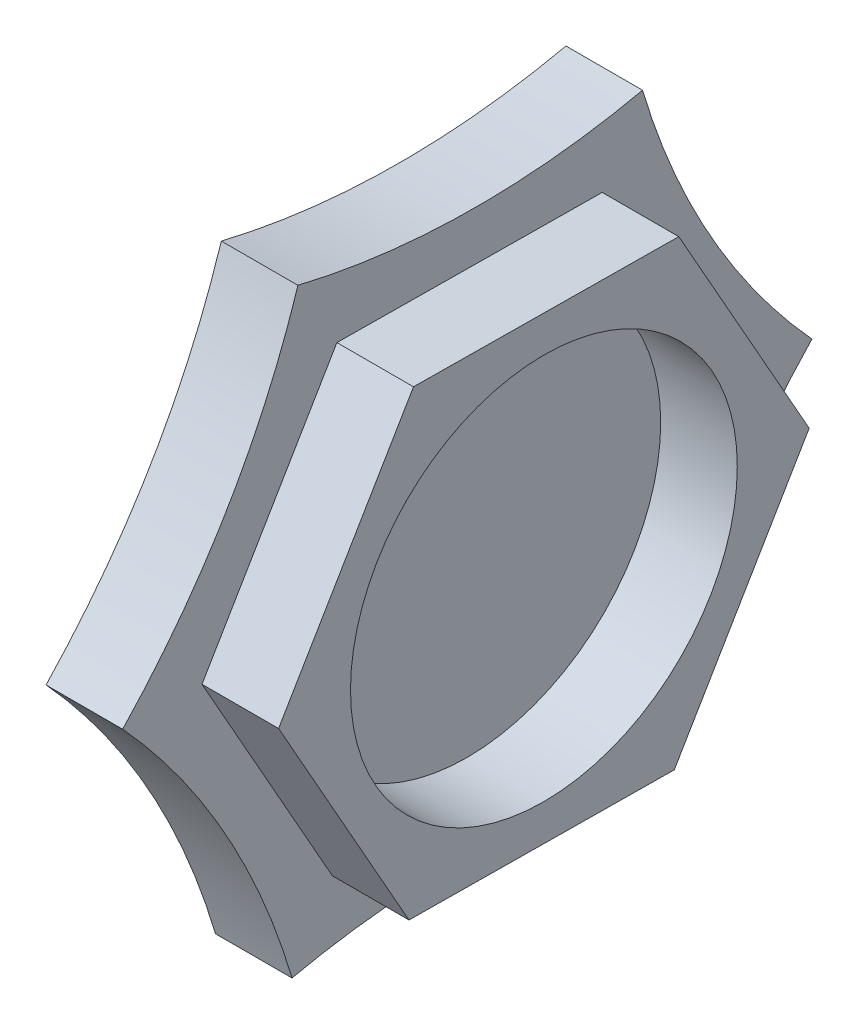
from build123d import *

# Parameters (mm, degrees)
BOSS_EXTRUDE1_DEPTH = 5.08
BOSS_EXTRUDE2_DEPTH = 5.08
SKETCH3_R           = 12.827
CUT_EXTRUDE1_DEPTH  = 5.08
CUT_EXTRUDE2_DEPTH  = 0.254


with BuildPart() as part:
    # Sketch1 → Boss-Extrude1 (new body)
    with BuildSketch(Plane(origin=(0, 0, 0), x_dir=(0, 0, -1), z_dir=(1, 0, 0))):
        with BuildLine():
            ThreePointArc((-11.624458926, -19.685069817), (-0.181663781, -18.494701427), (11.235541074, -19.909611644))
            ThreePointArc((11.235541074, -19.909611644), (15.92604938, -9.404676163), (22.86, -0.224541827))
            ThreePointArc((22.86, -0.224541827), (16.107713162, 9.090025264), (11.624458926, 19.685069817))
            ThreePointArc((11.624458926, 19.685069817), (0.181663781, 18.494701427), (-11.235541074, 19.909611644))
            ThreePointArc((-11.235541074, 19.909611644), (-15.92604938, 9.404676163), (-22.86, 0.224541827))
            ThreePointArc((-22.86, 0.224541827), (-16.107713162, -9.090025264), (-11.624458926, -19.685069817))
        make_face()
    extrude(amount=BOSS_EXTRUDE1_DEPTH)

    # Sketch2 → Boss-Extrude2 (add)
    with BuildSketch(Plane(origin=(5.08, 0, 0), x_dir=(0, 0, -1), z_dir=(1, 0, 0))):
        Polygon((8.648706343, -15.325686888), (17.596787347, -0.172844041), (8.948081004, 15.152842847), (-8.648706343, 15.325686888), (-17.596787347, 0.172844041), (-8.948081004, -15.152842847), align=None)
    extrude(amount=BOSS_EXTRUDE2_DEPTH)

    # Sketch3 → Cut-Extrude1 (cut)
    with BuildSketch(Plane(origin=(10.16, 0, 0), x_dir=(0, 0, -1), z_dir=(1, 0, 0))):
        Circle(SKETCH3_R)
    extrude(amount=-CUT_EXTRUDE1_DEPTH, mode=Mode.SUBTRACT)

    # Sketch4 → Cut-Extrude2 (cut)
    # profile 1 of 12: a face of its own
    with BuildSketch(Plane.ZY):
        with BuildLine():
            Line((-6.151828843, 2.577396125), (-6.583048795, 2.164620684))
            add(Edge.make_bspline(
                [(-6.583048795, 2.164620684), (-6.617189231, 2.198802026), (-6.684178403, 2.265871463), (-6.793730813, 2.353166944), (-6.907193862, 2.427385361), (-7.024941003, 2.488412934), (-7.147136256, 2.535751226), (-7.27353848, 2.569613821), (-7.404353314, 2.5896983), (-7.492909117, 2.592510059), (-7.537711255, 2.593932583)],
                knots=[0, 0, 0, 0, 1.075575784, 2.110457258, 3.113929901, 4.09197124, 5.059417775, 6.02750972, 7.002078037, 8, 8, 8, 8], degree=3))
            add(Edge.make_bspline(
                [(-7.537711255, 2.593932583), (-7.576553338, 2.592935827), (-7.652823174, 2.590978608), (-7.764894352, 2.576115623), (-7.871985228, 2.551287676), (-7.974601743, 2.5168927), (-8.072117388, 2.472133965), (-8.165097186, 2.417702271), (-8.252968939, 2.35318121), (-8.335040721, 2.279793877), (-8.409767342, 2.199669726), (-8.475007628, 2.113908552), (-8.530578336, 2.024108871), (-8.576324362, 1.929811254), (-8.611132113, 1.831160429), (-8.635980293, 1.728228012), (-8.651752708, 1.621313139), (-8.653614959, 1.548374705), (-8.65455821, 1.51143058)],
                knots=[0, 0, 0, 0, 1.075001177, 2.110859044, 3.123021556, 4.114053297, 5.101481495, 6.087880186, 7.091499647, 8.114004866, 9.131394192, 10.11971144, 11.092043119, 12.050101265, 13.015322563, 13.981809771, 14.977764287, 16, 16, 16, 16], degree=3))
            add(Edge.make_bspline(
                [(-8.65455821, 1.51143058), (-8.65367839, 1.473207769), (-8.651945026, 1.3979036), (-8.635294102, 1.287391493), (-8.609640488, 1.181070884), (-8.572090436, 1.079730645), (-8.525877694, 0.981982557), (-8.467272323, 0.889720094), (-8.398932596, 0.801534306), (-8.320980626, 0.718960559), (-8.236189014, 0.642847437), (-8.144356939, 0.577190298), (-8.048278496, 0.52054236), (-7.946402975, 0.475679024), (-7.840498633, 0.439658681), (-7.729491296, 0.414261247), (-7.613630925, 0.39868001), (-7.534580439, 0.396806482), (-7.494462056, 0.39585566)],
                knots=[0, 0, 0, 0, 1.022067601, 2.013613092, 2.983553406, 3.943623673, 4.90013463, 5.87121881, 6.861774014, 7.881098904, 8.905697761, 9.905387765, 10.89678721, 11.884561068, 12.87834324, 13.885584958, 14.926927371, 16, 16, 16, 16], degree=3))
            add(Edge.make_bspline(
                [(-7.494462056, 0.39585566), (-7.468366533, 0.396091115), (-7.417135216, 0.396553367), (-7.341987604, 0.404057005), (-7.270014241, 0.414784329), (-7.200936395, 0.428986033), (-7.135451566, 0.449083991), (-7.072653072, 0.472586078), (-7.012908857, 0.500323227), (-6.956542848, 0.533252422), (-6.902716155, 0.570162023), (-6.851932606, 0.612394457), (-6.803301399, 0.658997535), (-6.757390782, 0.710540582), (-6.714977806, 0.767484453), (-6.674703667, 0.828782728), (-6.637029498, 0.895043756), (-6.614768825, 0.941833937), (-6.603401359, 0.965727455)],
                knots=[0, 0, 0, 0, 1.109579412, 2.178351274, 3.208885622, 4.204702371, 5.174744997, 6.119429583, 7.05542196, 7.97267548, 8.893247984, 9.828544973, 10.778894627, 11.756245826, 12.760884819, 13.796418446, 14.874735809, 16, 16, 16, 16], degree=3))
            Line((-6.603401359, 0.965727455), (-7.51481462, 0.965727455))
            Line((-7.51481462, 0.965727455), (-7.51481462, 1.53559925))
            Line((-7.51481462, 1.53559925), (-5.931766743, 1.53559925))
            Line((-5.931766743, 1.53559925), (-5.92731462, 1.400127495))
            add(Edge.make_bspline(
                [(-5.92731462, 1.400127495), (-5.927886685, 1.365334911), (-5.929029793, 1.295811833), (-5.939476606, 1.192303815), (-5.956781593, 1.090168615), (-5.980439167, 0.989508817), (-6.010088091, 0.889830648), (-6.047899751, 0.792088609), (-6.092176973, 0.695619846), (-6.14178646, 0.600834277), (-6.197533249, 0.509884947), (-6.257552852, 0.423767937), (-6.320989651, 0.342632298), (-6.389223367, 0.267608452), (-6.461191492, 0.198066165), (-6.537035693, 0.134272976), (-6.617024229, 0.076174908), (-6.700733369, 0.023281163), (-6.788639916, -0.023077083), (-6.88026056, -0.063402607), (-6.975456967, -0.097650223), (-7.074474912, -0.125725818), (-7.177119552, -0.147388373), (-7.283393085, -0.162242415), (-7.393353879, -0.172335904), (-7.46793796, -0.173449287), (-7.505910373, -0.174016135)],
                knots=[0, 0, 0, 0, 1.006889344, 2.011981806, 3.007738725, 4.003571281, 5.003404394, 6.015442001, 7.03424805, 8.074616296, 9.110249922, 10.119753985, 11.111721717, 12.089233633, 13.052717867, 14.006597561, 14.955430184, 15.912305663, 16.870361111, 17.829300583, 18.807640451, 19.796414044, 20.806216501, 21.841577364, 22.90109906, 24, 24, 24, 24], degree=3))
            add(Edge.make_bspline(
                [(-7.505910373, -0.174016135), (-7.546424364, -0.173456362), (-7.626735176, -0.172346725), (-7.745485477, -0.161954221), (-7.860790757, -0.144802064), (-7.972679777, -0.121064064), (-8.081412321, -0.091520228), (-8.186801568, -0.054435724), (-8.288631971, -0.010322534), (-8.387208462, 0.039651207), (-8.481271128, 0.096325783), (-8.570609158, 0.158707398), (-8.654734928, 0.227197325), (-8.734510148, 0.300649026), (-8.80807096, 0.380867953), (-8.878158687, 0.46525382), (-8.94137782, 0.556901565), (-9.000446593, 0.65283994), (-9.052923763, 0.753028743), (-9.098815803, 0.855614929), (-9.137952508, 0.960004525), (-9.168812746, 1.066683603), (-9.19386837, 1.174908308), (-9.211796138, 1.285149283), (-9.221920787, 1.397392729), (-9.223589885, 1.472826139), (-9.224430005, 1.510794562)],
                knots=[0, 0, 0, 0, 1.084149091, 2.14910686, 3.187506334, 4.202448172, 5.208724393, 6.201130722, 7.189831603, 8.176984443, 9.156919086, 10.126598231, 11.090766514, 12.05840148, 13.026036446, 14.001772938, 14.991905635, 16.003017641, 17.015720547, 18.016462227, 19.009322657, 19.99686681, 20.986544154, 21.980959929, 22.983742515, 24, 24, 24, 24], degree=3))
            add(Edge.make_bspline(
                [(-9.224430005, 1.510794562), (-9.223304906, 1.562591605), (-9.221083169, 1.664875407), (-9.200506516, 1.815540097), (-9.168430578, 1.961293152), (-9.122398379, 2.101603748), (-9.063328197, 2.236665165), (-8.992056815, 2.366794466), (-8.907036064, 2.491853335), (-8.841224163, 2.569282145), (-8.807838458, 2.608560988)],
                knots=[0, 0, 0, 0, 1.034044851, 2.041932006, 3.031217818, 4.011390712, 4.986069675, 5.97149666, 6.970960976, 8, 8, 8, 8], degree=3))
            add(Edge.make_bspline(
                [(-8.807838458, 2.608560988), (-8.7871096, 2.63128499), (-8.745963129, 2.676391792), (-8.680190569, 2.739068611), (-8.612749999, 2.797987139), (-8.542707355, 2.851898047), (-8.47043084, 2.901981469), (-8.395712428, 2.947298553), (-8.318944075, 2.989292218), (-8.239527081, 3.025818108), (-8.157877204, 3.058566616), (-8.073632831, 3.086276458), (-7.987424934, 3.110820791), (-7.89849014, 3.129492734), (-7.807726902, 3.145041303), (-7.714490952, 3.155462769), (-7.619036364, 3.163100961), (-7.554475682, 3.163568051), (-7.521810814, 3.163804378)],
                knots=[0, 0, 0, 0, 1.020590567, 2.025856924, 3.013483481, 3.991664875, 4.957826714, 5.930500614, 6.890802512, 7.860442893, 8.829981142, 9.809047939, 10.802672283, 11.803273349, 12.823572789, 13.857849586, 14.916166035, 16, 16, 16, 16], degree=3))
            add(Edge.make_bspline(
                [(-7.521810814, 3.163804378), (-7.487665422, 3.163277797), (-7.419728629, 3.162230095), (-7.318717869, 3.15498068), (-7.219110721, 3.14379654), (-7.12132694, 3.127019693), (-7.025038363, 3.106330348), (-6.930743401, 3.079822176), (-6.837826899, 3.049704118), (-6.777338607, 3.025691777), (-6.747141343, 3.013704218)],
                knots=[0, 0, 0, 0, 1.03180557, 2.052914215, 3.058998889, 4.059601663, 5.049854447, 6.033765722, 7.018406786, 8, 8, 8, 8], degree=3))
            add(Edge.make_bspline(
                [(-6.747141343, 3.013704218), (-6.72173408, 3.002625555), (-6.670056411, 2.980091861), (-6.594871772, 2.938865411), (-6.519503435, 2.89316116), (-6.444764665, 2.841308053), (-6.370769342, 2.783403082), (-6.296744876, 2.720360843), (-6.223446935, 2.65144623), (-6.176010709, 2.60239916), (-6.151828843, 2.577396125)],
                knots=[0, 0, 0, 0, 0.894392155, 1.819168899, 2.76525314, 3.739198753, 4.75366411, 5.797420238, 6.877176959, 8, 8, 8, 8], degree=3))
        make_face()
    # profile 2 of 12: a face of its own
    with BuildSketch(Plane.ZY):
        with BuildLine():
            Line((-3.120747505, 0.961404664), (-4.950570221, 0.961404664))
            add(Edge.make_bspline(
                [(-4.950570221, 0.961404664), (-4.94683936, 0.940143162), (-4.939507925, 0.898362633), (-4.923587451, 0.83767279), (-4.903270539, 0.780479706), (-4.878922, 0.726706929), (-4.85095235, 0.676070182), (-4.818328069, 0.628806971), (-4.781462969, 0.584959044), (-4.740570192, 0.544716967), (-4.696331348, 0.508659194), (-4.648960978, 0.477070305), (-4.598410198, 0.451169349), (-4.545258556, 0.42933753), (-4.489108885, 0.412044518), (-4.429878547, 0.400117857), (-4.367724554, 0.393072734), (-4.325383354, 0.392053738), (-4.303740293, 0.391532869)],
                knots=[0, 0, 0, 0, 1.091296461, 2.144483647, 3.168565212, 4.157007626, 5.126487748, 6.090021542, 7.05641414, 8.019231907, 8.98705074, 9.938580405, 10.892824166, 11.854447369, 12.841318655, 13.858982407, 14.905600794, 16, 16, 16, 16], degree=3))
            add(Edge.make_bspline(
                [(-4.303740293, 0.391532869), (-4.277615649, 0.392222585), (-4.226168531, 0.393580838), (-4.150798121, 0.405626531), (-4.077903955, 0.423821019), (-4.008175869, 0.450877751), (-3.940806173, 0.484558626), (-3.876903978, 0.526520851), (-3.815363189, 0.575538154), (-3.777816055, 0.613320673), (-3.758673186, 0.63258355)],
                knots=[0, 0, 0, 0, 1.021034703, 2.010718019, 2.977989445, 3.954245119, 4.929443971, 5.918328161, 6.938689359, 8, 8, 8, 8], degree=3))
            Line((-3.758673186, 0.63258355), (-3.281659965, 0.405525257))
            add(Edge.make_bspline(
                [(-3.281659965, 0.405525257), (-3.296678448, 0.384772018), (-3.326437019, 0.34365024), (-3.375016888, 0.285781277), (-3.425713075, 0.231787187), (-3.478563389, 0.182023097), (-3.533634857, 0.136630816), (-3.590774284, 0.095057382), (-3.650816739, 0.058419027), (-3.712561684, 0.024943209), (-3.777285501, -0.003755455), (-3.844809071, -0.028228663), (-3.914846394, -0.050352234), (-3.98828189, -0.067209184), (-4.064504062, -0.080553007), (-4.143695248, -0.09002889), (-4.225845011, -0.095881688), (-4.281681727, -0.096575531), (-4.310100469, -0.096928669)],
                knots=[0, 0, 0, 0, 1.028154879, 2.037251081, 3.030720504, 4.000128189, 4.949298328, 5.894184978, 6.834267904, 7.770992897, 8.712077017, 9.673380525, 10.653304757, 11.658697181, 12.695551717, 13.758623199, 14.859225354, 16, 16, 16, 16], degree=3))
            add(Edge.make_bspline(
                [(-4.310100469, -0.096928669), (-4.353822238, -0.096037314), (-4.439448801, -0.094291646), (-4.564693129, -0.078089349), (-4.683640502, -0.051224193), (-4.796626788, -0.01470514), (-4.903163583, 0.033511451), (-5.003303613, 0.092484341), (-5.09804742, 0.161082902), (-5.184500052, 0.240746836), (-5.263260951, 0.327456292), (-5.332439627, 0.420576326), (-5.390327358, 0.519456344), (-5.437865927, 0.623441938), (-5.474814554, 0.73279927), (-5.501452371, 0.847576061), (-5.517781672, 0.967717492), (-5.519545318, 1.049547217), (-5.520442016, 1.09115226)],
                knots=[0, 0, 0, 0, 1.103565453, 2.161269334, 3.182010356, 4.179077853, 5.15417608, 6.128274628, 7.109042802, 8.101804412, 9.090965879, 10.063106201, 11.02526161, 11.978650795, 12.945248442, 13.93468508, 14.949922959, 16, 16, 16, 16], degree=3))
            add(Edge.make_bspline(
                [(-5.520442016, 1.09115226), (-5.519536493, 1.13381454), (-5.517754916, 1.217750661), (-5.501592966, 1.340666213), (-5.47474091, 1.457944273), (-5.4376842, 1.569746348), (-5.390866797, 1.676422106), (-5.332242543, 1.777038262), (-5.26329528, 1.871945106), (-5.184818116, 1.960698655), (-5.097999244, 2.040808429), (-5.00574599, 2.112202247), (-4.907021794, 2.171692316), (-4.802943312, 2.219760254), (-4.694176268, 2.258814241), (-4.579463465, 2.284801407), (-4.459677695, 2.302250234), (-4.37779478, 2.303857162), (-4.336177192, 2.304673895)],
                knots=[0, 0, 0, 0, 1.079208495, 2.12329425, 3.130605359, 4.119693003, 5.099659317, 6.073216462, 7.060498243, 8.06384408, 9.066070512, 10.045757761, 11.010926815, 11.975797609, 12.942977511, 13.929384301, 14.947594487, 16, 16, 16, 16], degree=3))
            add(Edge.make_bspline(
                [(-4.336177192, 2.304673895), (-4.292245967, 2.303768711), (-4.205991534, 2.301991475), (-4.079874918, 2.285920736), (-3.960137748, 2.25889176), (-3.846269877, 2.222688481), (-3.739725444, 2.173253888), (-3.638163345, 2.115732227), (-3.544019615, 2.045650856), (-3.456290782, 1.966376772), (-3.37709758, 1.878424923), (-3.307873948, 1.782882278), (-3.248973156, 1.680681275), (-3.20123348, 1.57140747), (-3.164322793, 1.455388911), (-3.137660317, 1.332776273), (-3.12145557, 1.203103195), (-3.119724742, 1.114308607), (-3.118839452, 1.068891643)],
                knots=[0, 0, 0, 0, 1.080001299, 2.120471247, 3.119684163, 4.095710327, 5.052285597, 6.002875087, 6.961153713, 7.931888285, 8.906493152, 9.865905668, 10.82813294, 11.801621613, 12.7925306, 13.817193356, 14.883530496, 16, 16, 16, 16], degree=3))
            Line((-3.118839452, 1.068891643), (-3.120747505, 0.961404664))
        make_face()
        with BuildLine():
            add(Edge.make_bspline(
                [(-3.688711247, 1.409161074), (-3.699465076, 1.438181303), (-3.72084649, 1.495881079), (-3.769146215, 1.57549269), (-3.833238404, 1.644439578), (-3.907782217, 1.705478805), (-3.992953192, 1.755022055), (-4.086067442, 1.790892976), (-4.185948019, 1.812401631), (-4.254660475, 1.814924218), (-4.289747905, 1.816212356)],
                knots=[0, 0, 0, 0, 0.954238005, 1.897273737, 2.851915805, 3.847685534, 4.862635127, 5.880135777, 6.917509367, 8, 8, 8, 8], degree=3))
            add(Edge.make_bspline(
                [(-4.289747905, 1.816212356), (-4.328069093, 1.814974943), (-4.402979034, 1.812556058), (-4.511031525, 1.786830327), (-4.612954735, 1.748435443), (-4.673042884, 1.708849502), (-4.703159364, 1.689008831)],
                knots=[0, 0, 0, 0, 1.044195649, 2.041185066, 3.018232172, 4, 4, 4, 4], degree=3))
            add(Edge.make_bspline(
                [(-4.703159364, 1.689008831), (-4.721949798, 1.673897741), (-4.762010043, 1.641681669), (-4.814036399, 1.577413666), (-4.865282793, 1.499599541), (-4.894419193, 1.440494216), (-4.909865093, 1.409161074)],
                knots=[0, 0, 0, 0, 0.82159062, 1.751589201, 2.808063854, 4, 4, 4, 4], degree=3))
            Line((-4.909865093, 1.409161074), (-3.688711247, 1.409161074))
        make_face(mode=Mode.SUBTRACT)
    # profile 3 of 12: a face of its own
    with BuildSketch(Plane.ZY):
        with BuildLine():
            Line((-2.630513395, 2.291555374), (-2.0606416, 2.291555374))
            Line((-2.0606416, 2.291555374), (-2.0606416, 2.046052569))
            add(Edge.make_bspline(
                [(-2.0606416, 2.046052569), (-2.028130696, 2.07134022), (-1.96599604, 2.119669835), (-1.871540634, 2.181290341), (-1.782386426, 2.231724251), (-1.696546072, 2.270086863), (-1.612404484, 2.297687114), (-1.528598928, 2.317516247), (-1.44388137, 2.330213386), (-1.386930608, 2.331578496), (-1.358478138, 2.332260502)],
                knots=[0, 0, 0, 0, 1.276643801, 2.439914479, 3.493451431, 4.44993799, 5.350072675, 6.235028322, 7.118224225, 8, 8, 8, 8], degree=3))
            add(Edge.make_bspline(
                [(-1.358478138, 2.332260502), (-1.329616937, 2.33148111), (-1.272959974, 2.329951099), (-1.189535719, 2.319249911), (-1.109831945, 2.299759657), (-1.032952449, 2.273881872), (-0.959679732, 2.239724679), (-0.889116159, 2.199168555), (-0.822777412, 2.149768451), (-0.781923074, 2.112147704), (-0.761257585, 2.093117874)],
                knots=[0, 0, 0, 0, 1.048836932, 2.058954983, 3.049370783, 4.026390553, 5.001981509, 5.982488534, 6.97947532, 8, 8, 8, 8], degree=3))
            add(Edge.make_bspline(
                [(-0.761257585, 2.093117874), (-0.744683103, 2.075482786), (-0.711412832, 2.040083542), (-0.669546377, 1.979506369), (-0.633620249, 1.913466163), (-0.60418378, 1.841201128), (-0.582431414, 1.762314215), (-0.565697023, 1.677758265), (-0.556307064, 1.587059828), (-0.555147829, 1.524750857), (-0.554551856, 1.492717233)],
                knots=[0, 0, 0, 0, 0.889584746, 1.785680191, 2.700364693, 3.65222533, 4.649950538, 5.707241244, 6.821271309, 8, 8, 8, 8], degree=3))
            Line((-0.554551856, 1.492717233), (-0.554551856, -0.028636934))
            Line((-0.554551856, -0.028636934), (-1.124423651, -0.028636934))
            Line((-1.124423651, -0.028636934), (-1.124423651, 0.978814989))
            add(Edge.make_bspline(
                [(-1.124423651, 0.978814989), (-1.124544166, 1.011676316), (-1.124775111, 1.074648949), (-1.12654826, 1.164772251), (-1.130010478, 1.246165297), (-1.133166199, 1.318976279), (-1.139362136, 1.382946669), (-1.144949731, 1.43848145), (-1.153523354, 1.485076806), (-1.164679029, 1.535197102), (-1.184159585, 1.588860044), (-1.214402198, 1.645402819), (-1.252769194, 1.693437167), (-1.297693511, 1.733299832), (-1.349125535, 1.764834857), (-1.406443783, 1.787021711), (-1.469340962, 1.800849104), (-1.513166977, 1.802326554), (-1.535927056, 1.803093835)],
                knots=[0, 0, 0, 0, 1.49886392, 2.872294502, 4.110984203, 5.214877267, 6.195405875, 7.042225351, 7.75923308, 8.355011229, 9.382752534, 10.352059385, 11.267231453, 12.171456522, 13.078624015, 14.003401117, 14.963110155, 16, 16, 16, 16], degree=3))
            add(Edge.make_bspline(
                [(-1.535927056, 1.803093835), (-1.565527497, 1.801592789), (-1.623431715, 1.798656451), (-1.707178581, 1.776513781), (-1.784098682, 1.738855617), (-1.853563518, 1.686744291), (-1.914911494, 1.622406401), (-1.965439315, 1.545676087), (-2.006882507, 1.458405231), (-2.024703696, 1.39468333), (-2.033928859, 1.361697601)],
                knots=[0, 0, 0, 0, 0.984188326, 1.925263693, 2.85911992, 3.81709677, 4.80007086, 5.801799564, 6.862098548, 8, 8, 8, 8], degree=3))
            add(Edge.make_bspline(
                [(-2.033928859, 1.361697601), (-2.036221679, 1.351338212), (-2.041335127, 1.328234692), (-2.045540291, 1.289203819), (-2.05138998, 1.242897468), (-2.053581715, 1.188477623), (-2.0573929, 1.126201831), (-2.058802459, 1.055987703), (-2.060214539, 0.977972916), (-2.06049453, 0.923482552), (-2.0606416, 0.894860662)],
                knots=[0, 0, 0, 0, 0.543362196, 1.211806945, 2.009705693, 2.934833164, 4.000995085, 5.207458376, 6.533175157, 8, 8, 8, 8], degree=3))
            Line((-2.0606416, 0.894860662), (-2.0606416, -0.028636934))
            Line((-2.0606416, -0.028636934), (-2.630513395, -0.028636934))
            Line((-2.630513395, -0.028636934), (-2.630513395, 2.291555374))
        make_face()
    # profile 4 of 12: a face of its own
    with BuildSketch(Plane.ZY):
        with BuildLine():
            Line((2.333476566, 1.014978655), (0.50365385, 1.014978655))
            add(Edge.make_bspline(
                [(0.50365385, 1.014978655), (0.507384711, 0.993717153), (0.514716147, 0.951936624), (0.53063662, 0.891246781), (0.550953532, 0.834053697), (0.575302071, 0.78028092), (0.603271722, 0.729644173), (0.635896002, 0.682380962), (0.672761102, 0.638533035), (0.713653879, 0.598290958), (0.757892723, 0.562233185), (0.805263094, 0.530644296), (0.855813873, 0.50474334), (0.908965515, 0.482911521), (0.965115186, 0.465618509), (1.024345524, 0.453691848), (1.086499518, 0.446646725), (1.128840717, 0.445627729), (1.150483778, 0.44510686)],
                knots=[0, 0, 0, 0, 1.091296461, 2.144483647, 3.168565212, 4.157007626, 5.126487748, 6.090021542, 7.05641414, 8.019231907, 8.98705074, 9.938580405, 10.892824166, 11.854447369, 12.841318655, 13.858982407, 14.905600794, 16, 16, 16, 16], degree=3))
            add(Edge.make_bspline(
                [(1.150483778, 0.44510686), (1.176608422, 0.445796576), (1.22805554, 0.44715483), (1.30342595, 0.459200522), (1.376320117, 0.47739501), (1.446048202, 0.504451742), (1.513417899, 0.538132617), (1.577320093, 0.580094842), (1.638860882, 0.629112145), (1.676408016, 0.666894664), (1.695550885, 0.686157541)],
                knots=[0, 0, 0, 0, 1.021034703, 2.010718019, 2.977989445, 3.954245119, 4.929443971, 5.918328161, 6.938689359, 8, 8, 8, 8], degree=3))
            Line((1.695550885, 0.686157541), (2.172564107, 0.459099248))
            add(Edge.make_bspline(
                [(2.172564107, 0.459099248), (2.157545624, 0.43834601), (2.127787052, 0.397224231), (2.079207183, 0.339355268), (2.028510996, 0.285361178), (1.975660682, 0.235597088), (1.920589214, 0.190204807), (1.863449787, 0.148631373), (1.803407332, 0.111993018), (1.741662387, 0.0785172), (1.67693857, 0.049818536), (1.609415, 0.025345328), (1.539377677, 0.003221757), (1.465942181, -0.013635192), (1.38972001, -0.026979016), (1.310528823, -0.036454899), (1.22837906, -0.042307697), (1.172542344, -0.043001539), (1.144123602, -0.043354678)],
                knots=[0, 0, 0, 0, 1.028154879, 2.037251081, 3.030720504, 4.000128189, 4.949298328, 5.894184978, 6.834267904, 7.770992897, 8.712077017, 9.673380525, 10.653304757, 11.658697181, 12.695551717, 13.758623199, 14.859225354, 16, 16, 16, 16], degree=3))
            add(Edge.make_bspline(
                [(1.144123602, -0.043354678), (1.100401833, -0.042463323), (1.01477527, -0.040717655), (0.889530942, -0.024515358), (0.770583569, 0.002349798), (0.657597283, 0.038868851), (0.551060488, 0.087085442), (0.450920458, 0.146058332), (0.356176651, 0.214656893), (0.269724019, 0.294320827), (0.190963121, 0.381030283), (0.121784444, 0.474150317), (0.063896713, 0.573030335), (0.016358144, 0.677015929), (-0.020590483, 0.786373261), (-0.0472283, 0.901150052), (-0.063557601, 1.021291483), (-0.065321247, 1.103121208), (-0.066217945, 1.144726251)],
                knots=[0, 0, 0, 0, 1.103565453, 2.161269334, 3.182010356, 4.179077853, 5.15417608, 6.128274628, 7.109042802, 8.101804412, 9.090965879, 10.063106201, 11.02526161, 11.978650795, 12.945248442, 13.93468508, 14.949922959, 16, 16, 16, 16], degree=3))
            add(Edge.make_bspline(
                [(-0.066217945, 1.144726251), (-0.065312421, 1.187388532), (-0.063530845, 1.271324652), (-0.047368895, 1.394240204), (-0.020516839, 1.511518265), (0.016539872, 1.623320339), (0.063357275, 1.729996097), (0.121981528, 1.830612253), (0.190928791, 1.925519097), (0.269405955, 2.014272646), (0.356224827, 2.09438242), (0.448478081, 2.165776239), (0.547202277, 2.225266307), (0.651280759, 2.273334245), (0.760047804, 2.312388232), (0.874760606, 2.338375398), (0.994546376, 2.355824225), (1.076429291, 2.357431153), (1.118046879, 2.358247886)],
                knots=[0, 0, 0, 0, 1.079208495, 2.12329425, 3.130605359, 4.119693003, 5.099659317, 6.073216462, 7.060498243, 8.06384408, 9.066070512, 10.045757761, 11.010926815, 11.975797609, 12.942977511, 13.929384301, 14.947594487, 16, 16, 16, 16], degree=3))
            add(Edge.make_bspline(
                [(1.118046879, 2.358247886), (1.161978104, 2.357342702), (1.248232538, 2.355565466), (1.374349153, 2.339494728), (1.494086323, 2.312465751), (1.607954194, 2.276262472), (1.714498627, 2.226827879), (1.816060726, 2.169306218), (1.910204457, 2.099224847), (1.997933289, 2.019950763), (2.077126491, 1.931998914), (2.146350123, 1.836456269), (2.205250915, 1.734255266), (2.252990591, 1.624981461), (2.289901279, 1.508962902), (2.316563754, 1.386350264), (2.332768501, 1.256677186), (2.334499329, 1.167882598), (2.335384619, 1.122465634)],
                knots=[0, 0, 0, 0, 1.080001299, 2.120471247, 3.119684163, 4.095710327, 5.052285597, 6.002875087, 6.961153713, 7.931888285, 8.906493152, 9.865905668, 10.82813294, 11.801621613, 12.7925306, 13.817193356, 14.883530496, 16, 16, 16, 16], degree=3))
            Line((2.335384619, 1.122465634), (2.333476566, 1.014978655))
        make_face()
        with BuildLine():
            add(Edge.make_bspline(
                [(1.765512824, 1.462735065), (1.754758995, 1.491755294), (1.733377581, 1.54945507), (1.685077857, 1.629066681), (1.620985668, 1.698013569), (1.546441854, 1.759052796), (1.461270879, 1.808596046), (1.36815663, 1.844466967), (1.268276052, 1.865975622), (1.199563597, 1.868498209), (1.164476166, 1.869786347)],
                knots=[0, 0, 0, 0, 0.954238005, 1.897273737, 2.851915805, 3.847685534, 4.862635127, 5.880135777, 6.917509367, 8, 8, 8, 8], degree=3))
            add(Edge.make_bspline(
                [(1.164476166, 1.869786347), (1.126154979, 1.868548934), (1.051245037, 1.866130049), (0.943192546, 1.840404318), (0.841269336, 1.802009434), (0.781181188, 1.762423493), (0.751064707, 1.742582822)],
                knots=[0, 0, 0, 0, 1.044195649, 2.041185066, 3.018232172, 4, 4, 4, 4], degree=3))
            add(Edge.make_bspline(
                [(0.751064707, 1.742582822), (0.732274273, 1.727471732), (0.692214028, 1.69525566), (0.640187672, 1.630987657), (0.588941278, 1.553173532), (0.559804878, 1.494068207), (0.544358978, 1.462735065)],
                knots=[0, 0, 0, 0, 0.82159062, 1.751589201, 2.808063854, 4, 4, 4, 4], degree=3))
            Line((0.544358978, 1.462735065), (1.765512824, 1.462735065))
        make_face(mode=Mode.SUBTRACT)
    # profile 5 of 12: a face of its own
    with BuildSketch(Plane.ZY):
        Polygon((2.559127343, 2.345129365), (3.13917542, 2.345129365), (3.739576061, 0.975783411), (4.338068649, 2.345129365), (4.920024779, 2.345129365), (3.904304627, 0.024937057), (3.575483513, 0.024937057), align=None)
    # profile 6 of 12: a face of its own
    with BuildSketch(Plane.ZY):
        with BuildLine():
            Line((7.584184814, 1.066553616), (5.754362098, 1.066553616))
            add(Edge.make_bspline(
                [(5.754362098, 1.066553616), (5.758092959, 1.045292115), (5.765424394, 1.003511586), (5.781344868, 0.942821743), (5.801661779, 0.885628659), (5.826010319, 0.831855881), (5.853979969, 0.781219134), (5.886604249, 0.733955924), (5.92346935, 0.690107996), (5.964362127, 0.649865919), (6.008600971, 0.613808146), (6.055971341, 0.582219258), (6.10652212, 0.556318301), (6.159673763, 0.534486483), (6.215823434, 0.517193471), (6.275053772, 0.505266809), (6.337207765, 0.498221687), (6.379548964, 0.49720269), (6.401192026, 0.496681822)],
                knots=[0, 0, 0, 0, 1.091296461, 2.144483647, 3.168565212, 4.157007626, 5.126487748, 6.090021542, 7.05641414, 8.019231907, 8.98705074, 9.938580405, 10.892824166, 11.854447369, 12.841318655, 13.858982407, 14.905600794, 16, 16, 16, 16], degree=3))
            add(Edge.make_bspline(
                [(6.401192026, 0.496681822), (6.42731667, 0.497371537), (6.478763788, 0.498729791), (6.554134198, 0.510775483), (6.627028364, 0.528969972), (6.69675645, 0.556026704), (6.764126146, 0.589707578), (6.82802834, 0.631669804), (6.88956913, 0.680687107), (6.927116263, 0.718469626), (6.946259133, 0.737732503)],
                knots=[0, 0, 0, 0, 1.021034703, 2.010718019, 2.977989445, 3.954245119, 4.929443971, 5.918328161, 6.938689359, 8, 8, 8, 8], degree=3))
            Line((6.946259133, 0.737732503), (7.423272354, 0.510674209))
            add(Edge.make_bspline(
                [(7.423272354, 0.510674209), (7.408253871, 0.489920971), (7.3784953, 0.448799193), (7.329915431, 0.39093023), (7.279219243, 0.33693614), (7.22636893, 0.28717205), (7.171297462, 0.241779768), (7.114158035, 0.200206335), (7.05411558, 0.16356798), (6.992370635, 0.130092161), (6.927646818, 0.101393497), (6.860123248, 0.07692029), (6.790085925, 0.054796719), (6.716650429, 0.037939769), (6.640428257, 0.024595945), (6.561237071, 0.015120063), (6.479087307, 0.009267264), (6.423250592, 0.008573422), (6.394831849, 0.008220283)],
                knots=[0, 0, 0, 0, 1.028154879, 2.037251081, 3.030720504, 4.000128189, 4.949298328, 5.894184978, 6.834267904, 7.770992897, 8.712077017, 9.673380525, 10.653304757, 11.658697181, 12.695551717, 13.758623199, 14.859225354, 16, 16, 16, 16], degree=3))
            add(Edge.make_bspline(
                [(6.394831849, 0.008220283), (6.351110081, 0.009111638), (6.265483518, 0.010857307), (6.14023919, 0.027059604), (6.021291816, 0.05392476), (5.908305531, 0.090443813), (5.801768736, 0.138660404), (5.701628706, 0.197633294), (5.606884899, 0.266231855), (5.520432267, 0.345895789), (5.441671368, 0.432605244), (5.372492692, 0.525725279), (5.314604961, 0.624605297), (5.267066392, 0.728590891), (5.230117765, 0.837948223), (5.203479948, 0.952725014), (5.187150646, 1.072866444), (5.185387001, 1.15469617), (5.184490303, 1.196301213)],
                knots=[0, 0, 0, 0, 1.103565453, 2.161269334, 3.182010356, 4.179077853, 5.15417608, 6.128274628, 7.109042802, 8.101804412, 9.090965879, 10.063106201, 11.02526161, 11.978650795, 12.945248442, 13.93468508, 14.949922959, 16, 16, 16, 16], degree=3))
            add(Edge.make_bspline(
                [(5.184490303, 1.196301213), (5.185395826, 1.238963493), (5.187177403, 1.322899614), (5.203339352, 1.445815165), (5.230191409, 1.563093226), (5.267248119, 1.674895301), (5.314065522, 1.781571059), (5.372689775, 1.882187214), (5.441637039, 1.977094058), (5.520114203, 2.065847607), (5.606933075, 2.145957382), (5.699186329, 2.2173512), (5.797910525, 2.276841268), (5.901989007, 2.324909207), (6.010756051, 2.363963193), (6.125468853, 2.38995036), (6.245254624, 2.407399186), (6.327137539, 2.409006114), (6.368755127, 2.409822847)],
                knots=[0, 0, 0, 0, 1.079208495, 2.12329425, 3.130605359, 4.119693003, 5.099659317, 6.073216462, 7.060498243, 8.06384408, 9.066070512, 10.045757761, 11.010926815, 11.975797609, 12.942977511, 13.929384301, 14.947594487, 16, 16, 16, 16], degree=3))
            add(Edge.make_bspline(
                [(6.368755127, 2.409822847), (6.412686352, 2.408917663), (6.498940785, 2.407140428), (6.625057401, 2.391069689), (6.744794571, 2.364040713), (6.858662442, 2.327837433), (6.965206875, 2.278402841), (7.066768974, 2.22088118), (7.160912704, 2.150799809), (7.248641537, 2.071525725), (7.327834738, 1.983573876), (7.397058371, 1.88803123), (7.455959162, 1.785830228), (7.503698838, 1.676556422), (7.540609526, 1.560537864), (7.567272002, 1.437925226), (7.583476749, 1.308252148), (7.585207577, 1.219457559), (7.586092867, 1.174040596)],
                knots=[0, 0, 0, 0, 1.080001299, 2.120471247, 3.119684163, 4.095710327, 5.052285597, 6.002875087, 6.961153713, 7.931888285, 8.906493152, 9.865905668, 10.82813294, 11.801621613, 12.7925306, 13.817193356, 14.883530496, 16, 16, 16, 16], degree=3))
            Line((7.586092867, 1.174040596), (7.584184814, 1.066553616))
        make_face()
        with BuildLine():
            add(Edge.make_bspline(
                [(7.016221072, 1.514310027), (7.005467243, 1.543330256), (6.984085829, 1.601030031), (6.935786104, 1.680641642), (6.871693915, 1.749588531), (6.797150101, 1.810627758), (6.711979127, 1.860171007), (6.618864877, 1.896041929), (6.518984299, 1.917550584), (6.450271844, 1.920073171), (6.415184413, 1.921361309)],
                knots=[0, 0, 0, 0, 0.954238005, 1.897273737, 2.851915805, 3.847685534, 4.862635127, 5.880135777, 6.917509367, 8, 8, 8, 8], degree=3))
            add(Edge.make_bspline(
                [(6.415184413, 1.921361309), (6.376863226, 1.920123896), (6.301953285, 1.917705011), (6.193900794, 1.89197928), (6.091977584, 1.853584396), (6.031889435, 1.813998455), (6.001772955, 1.794157783)],
                knots=[0, 0, 0, 0, 1.044195649, 2.041185066, 3.018232172, 4, 4, 4, 4], degree=3))
            add(Edge.make_bspline(
                [(6.001772955, 1.794157783), (5.982982521, 1.779046693), (5.942922276, 1.746830622), (5.89089592, 1.682562619), (5.839649526, 1.604748494), (5.810513126, 1.545643168), (5.795067226, 1.514310027)],
                knots=[0, 0, 0, 0, 0.82159062, 1.751589201, 2.808063854, 4, 4, 4, 4], degree=3))
            Line((5.795067226, 1.514310027), (7.016221072, 1.514310027))
        make_face(mode=Mode.SUBTRACT)
    # profile 7 of 12: a face of its own
    with BuildSketch(Plane.ZY):
        Polygon((8.440765078, 2.274588942), (8.115124053, 2.274588942), (7.993008668, 3.332922275), (8.562880463, 3.332922275), align=None)
    # profile 8 of 12: a face of its own
    with BuildSketch(Plane.ZY):
        with BuildLine():
            Line((10.475974365, 2.048221743), (10.127436704, 1.67360736))
            add(Edge.make_bspline(
                [(10.127436704, 1.67360736), (10.110032549, 1.692866002), (10.076744993, 1.729700487), (10.025784962, 1.779914123), (9.975583826, 1.821727249), (9.927077077, 1.856852017), (9.879274037, 1.883788515), (9.832572055, 1.903168722), (9.786948723, 1.915471566), (9.75670765, 1.917064123), (9.742010022, 1.91783813)],
                knots=[0, 0, 0, 0, 1.327646587, 2.539285, 3.655602211, 4.666613517, 5.598770349, 6.454635452, 7.248928967, 8, 8, 8, 8], degree=3))
            add(Edge.make_bspline(
                [(9.742010022, 1.91783813), (9.727137498, 1.917384866), (9.698661242, 1.916517007), (9.658474863, 1.909072956), (9.623168441, 1.896185931), (9.593292955, 1.878619716), (9.569290461, 1.856979942), (9.552485195, 1.832224551), (9.541200305, 1.805123495), (9.540245676, 1.785872568), (9.539756416, 1.776006199)],
                knots=[0, 0, 0, 0, 1.295068245, 2.479652818, 3.543291146, 4.55379989, 5.481948265, 6.332409746, 7.145336708, 8, 8, 8, 8], degree=3))
            add(Edge.make_bspline(
                [(9.539756416, 1.776006199), (9.541414075, 1.761054385), (9.544853526, 1.730031109), (9.568477784, 1.694048737), (9.599734383, 1.667505278), (9.635764204, 1.642805065), (9.684557909, 1.615187582), (9.721574052, 1.596277085), (9.742010022, 1.585836928)],
                knots=[0, 0, 0, 0, 0.916701701, 1.902049539, 2.5493345, 3.440293453, 4.586830489, 6, 6, 6, 6], degree=3))
            Line((9.742010022, 1.585836928), (9.948079733, 1.481530037))
            add(Edge.make_bspline(
                [(9.948079733, 1.481530037), (9.974295741, 1.4682184), (10.025159719, 1.442391323), (10.096669709, 1.400715868), (10.162717475, 1.360321023), (10.22197812, 1.318921764), (10.274814355, 1.277237333), (10.320850888, 1.234855527), (10.361204338, 1.193119929), (10.406204098, 1.137163902), (10.451217364, 1.062635026), (10.488744448, 0.965713697), (10.512675013, 0.861932264), (10.515322654, 0.790101177), (10.516679493, 0.753289852)],
                knots=[0, 0, 0, 0, 1.076693506, 2.088987655, 3.030641824, 3.911722491, 4.735175175, 5.493635918, 6.202154166, 6.859459289, 8.120623445, 9.372284821, 10.653373066, 12, 12, 12, 12], degree=3))
            add(Edge.make_bspline(
                [(10.516679493, 0.753289852), (10.515861989, 0.728455367), (10.514261917, 0.67984769), (10.504146599, 0.608301823), (10.485976868, 0.540272296), (10.462065529, 0.474698665), (10.429857673, 0.412766702), (10.390755757, 0.35417618), (10.345377215, 0.29815784), (10.292522401, 0.246627959), (10.234620836, 0.198602673), (10.170253476, 0.158209959), (10.102266364, 0.122695479), (10.02886339, 0.094961833), (9.951074487, 0.072477214), (9.868232846, 0.056895937), (9.780619564, 0.04709024), (9.720624636, 0.045974456), (9.689856576, 0.045402232)],
                knots=[0, 0, 0, 0, 0.976600749, 1.911466839, 2.833459288, 3.740827163, 4.650527853, 5.570709661, 6.506801416, 7.479409329, 8.468875524, 9.458587492, 10.461481786, 11.480119772, 12.538142914, 13.641687514, 14.790552763, 16, 16, 16, 16], degree=3))
            add(Edge.make_bspline(
                [(9.689856576, 0.045402232), (9.649091539, 0.046700372), (9.569073361, 0.049248506), (9.452212604, 0.066998447), (9.341865026, 0.097723892), (9.23793984, 0.140766311), (9.13980052, 0.195614152), (9.048848604, 0.263668317), (8.963507359, 0.343155707), (8.913854936, 0.404118833), (8.888474365, 0.435281038)],
                knots=[0, 0, 0, 0, 1.056901255, 2.07460411, 3.05625841, 4.019970729, 4.984811261, 5.963335951, 6.958928997, 8, 8, 8, 8], degree=3))
            Line((8.888474365, 0.435281038), (9.233831937, 0.818799668))
            add(Edge.make_bspline(
                [(9.233831937, 0.818799668), (9.250658924, 0.801051524), (9.284065997, 0.765815653), (9.340376822, 0.719352393), (9.399957663, 0.67700455), (9.463471797, 0.641446179), (9.526998765, 0.612734394), (9.58794765, 0.591196539), (9.645169802, 0.577661452), (9.682374169, 0.575564294), (9.700032858, 0.574568899)],
                knots=[0, 0, 0, 0, 1.087861918, 2.159761696, 3.243809206, 4.338405912, 5.394481878, 6.343674753, 7.213841449, 8, 8, 8, 8], degree=3))
            add(Edge.make_bspline(
                [(9.700032858, 0.574568899), (9.717681988, 0.575080029), (9.751608488, 0.576062564), (9.799826828, 0.586282847), (9.842564965, 0.603464653), (9.878808497, 0.627287663), (9.908954896, 0.654632841), (9.930196327, 0.685710795), (9.944242285, 0.718665256), (9.945949407, 0.74170576), (9.946807698, 0.753289852)],
                knots=[0, 0, 0, 0, 1.255011871, 2.412479185, 3.488767498, 4.514443302, 5.48617286, 6.365347346, 7.178144445, 8, 8, 8, 8], degree=3))
            add(Edge.make_bspline(
                [(9.946807698, 0.753289852), (9.946041848, 0.764198714), (9.94446941, 0.786596709), (9.93202037, 0.819657753), (9.912475133, 0.85239349), (9.885366955, 0.88489622), (9.850335127, 0.916902219), (9.807505021, 0.948155131), (9.757864727, 0.980322337), (9.72119758, 0.999521851), (9.701940911, 1.009604957)],
                knots=[0, 0, 0, 0, 0.704666567, 1.446816302, 2.258757648, 3.165368109, 4.175243826, 5.322435858, 6.59381024, 8, 8, 8, 8], degree=3))
            Line((9.701940911, 1.009604957), (9.513043675, 1.105007601))
            add(Edge.make_bspline(
                [(9.513043675, 1.105007601), (9.470194242, 1.127985181), (9.387939395, 1.172093521), (9.27676159, 1.24772995), (9.182665628, 1.328246433), (9.10557483, 1.41321041), (9.044148729, 1.50238345), (9.001299902, 1.596900901), (8.974344076, 1.695866716), (8.971378504, 1.763540614), (8.969884621, 1.797630798)],
                knots=[0, 0, 0, 0, 1.255999728, 2.41104856, 3.467751088, 4.449286722, 5.368722015, 6.253902015, 7.120417131, 8, 8, 8, 8], degree=3))
            add(Edge.make_bspline(
                [(8.969884621, 1.797630798), (8.970402687, 1.819724851), (8.971419735, 1.863099067), (8.982246825, 1.926797109), (8.998604233, 1.98802712), (9.021686299, 2.04688634), (9.051254022, 2.103433172), (9.087479612, 2.157416666), (9.130805019, 2.208738679), (9.179843213, 2.257233893), (9.234252628, 2.301400572), (9.292478705, 2.340542578), (9.354349221, 2.373884288), (9.42037194, 2.400466672), (9.489707676, 2.421624594), (9.562814121, 2.436006241), (9.639379368, 2.445153018), (9.691737785, 2.446378791), (9.718477369, 2.447004796)],
                knots=[0, 0, 0, 0, 0.959035663, 1.882742823, 2.798841253, 3.708806893, 4.623422363, 5.566085165, 6.527241613, 7.536786942, 8.55815439, 9.567237405, 10.580975912, 11.605536372, 12.654523293, 13.725718749, 14.838518481, 16, 16, 16, 16], degree=3))
            add(Edge.make_bspline(
                [(9.718477369, 2.447004796), (9.755445017, 2.445787669), (9.828819277, 2.443371886), (9.937031879, 2.423823353), (10.041554028, 2.390966781), (10.142092699, 2.345695919), (10.237354652, 2.288803312), (10.325245029, 2.219716472), (10.406358643, 2.140136631), (10.452538691, 2.079164284), (10.475974365, 2.048221743)],
                knots=[0, 0, 0, 0, 0.996590028, 1.978055413, 2.954661574, 3.945146934, 4.945404762, 5.939399542, 6.954276554, 8, 8, 8, 8], degree=3))
        make_face()
    # profile 9 of 12: a face of its own
    with BuildSketch(Plane.ZY):
        with BuildLine():
            Line((-5.0196557, -3.246320222), (-4.355653296, -3.246320222))
            add(Edge.make_bspline(
                [(-4.355653296, -3.246320222), (-4.311762939, -3.246476007), (-4.22734942, -3.246775627), (-4.105629735, -3.25150283), (-3.993813466, -3.25808112), (-3.891735058, -3.268119767), (-3.799438181, -3.281429798), (-3.716830334, -3.297120123), (-3.643913929, -3.315002611), (-3.580074019, -3.337285603), (-3.522461657, -3.36242048), (-3.468758926, -3.391300915), (-3.417781064, -3.423605314), (-3.369868802, -3.460183694), (-3.324605773, -3.500378019), (-3.281906584, -3.544228749), (-3.242374615, -3.592107719), (-3.206254649, -3.643712396), (-3.173334207, -3.697999332), (-3.144239441, -3.755043064), (-3.12057953, -3.814883263), (-3.099673461, -3.876655108), (-3.084615497, -3.941241639), (-3.074142904, -4.008014096), (-3.066475281, -4.077207525), (-3.066034429, -4.124214469), (-3.065809546, -4.148193219)],
                knots=[0, 0, 0, 0, 1.749336639, 3.364467119, 4.854658419, 6.213483162, 7.451590619, 8.570285859, 9.5643256, 10.440900261, 11.26203566, 12.067320669, 12.869050712, 13.665104639, 14.467235401, 15.27997916, 16.102287765, 16.939272006, 17.78853747, 18.631303466, 19.488103222, 20.351255419, 21.228522269, 22.127379805, 23.044756219, 24, 24, 24, 24], degree=3))
            add(Edge.make_bspline(
                [(-3.065809546, -4.148193219), (-3.066393711, -4.173221525), (-3.067539154, -4.222297471), (-3.07370913, -4.294386034), (-3.084985908, -4.363355328), (-3.10206623, -4.429003421), (-3.12169784, -4.492147378), (-3.147802847, -4.551622156), (-3.177264927, -4.608292727), (-3.212256178, -4.661357466), (-3.250657367, -4.711995046), (-3.295317142, -4.758265354), (-3.343342236, -4.802655243), (-3.397432314, -4.842384282), (-3.455203035, -4.880138805), (-3.517802242, -4.914354457), (-3.584821393, -4.94589134), (-3.631939174, -4.963478485), (-3.656033905, -4.972472065)],
                knots=[0, 0, 0, 0, 1.099860209, 2.156625411, 3.176576793, 4.16617041, 5.135385252, 6.078461593, 7.016046972, 7.938469504, 8.868247731, 9.803980173, 10.76021508, 11.73834243, 12.748633912, 13.790971185, 14.870363756, 16, 16, 16, 16], degree=3))
            Line((-3.656033905, -4.972472065), (-2.923341597, -6.421320222))
            Line((-2.923341597, -6.421320222), (-3.556815155, -6.421320222))
            Line((-3.556815155, -6.421320222), (-4.256434546, -5.037345863))
            Line((-4.256434546, -5.037345863), (-4.449783905, -5.037345863))
            Line((-4.449783905, -5.037345863), (-4.449783905, -6.421320222))
            Line((-4.449783905, -6.421320222), (-5.0196557, -6.421320222))
            Line((-5.0196557, -6.421320222), (-5.0196557, -3.246320222))
        make_face()
        with BuildLine():
            Line((-4.449783905, -4.467474068), (-4.227813752, -4.467474068))
            add(Edge.make_bspline(
                [(-4.227813752, -4.467474068), (-4.200676056, -4.467168425), (-4.148713199, -4.466583184), (-4.073983786, -4.463868596), (-4.006111656, -4.457327779), (-3.944805345, -4.449063701), (-3.889756364, -4.439521629), (-3.841455731, -4.425847261), (-3.799159207, -4.41119483), (-3.763368007, -4.392985659), (-3.732788829, -4.372277882), (-3.706385665, -4.348753333), (-3.684546463, -4.321526662), (-3.666571686, -4.291337774), (-3.652589263, -4.257919655), (-3.642383166, -4.22163916), (-3.636679467, -4.182083008), (-3.636023237, -4.154783877), (-3.635681341, -4.140561007)],
                knots=[0, 0, 0, 0, 1.688639943, 3.233382647, 4.650958383, 5.928841754, 7.082724185, 8.122798841, 9.049171256, 9.863274652, 10.613301712, 11.341792392, 12.054588806, 12.776240173, 13.521029143, 14.301969904, 15.115324896, 16, 16, 16, 16], degree=3))
            add(Edge.make_bspline(
                [(-3.635681341, -4.140561007), (-3.636327727, -4.123734313), (-3.637597433, -4.090681392), (-3.650196865, -4.043096774), (-3.670252439, -3.999053956), (-3.697743138, -3.958751931), (-3.732364099, -3.923420395), (-3.772094383, -3.892275364), (-3.817791466, -3.867648204), (-3.860103526, -3.851404391), (-3.898597611, -3.841685551), (-3.933337308, -3.834443157), (-3.973566086, -3.829310264), (-4.019314316, -3.823865918), (-4.070465384, -3.820335535), (-4.127298094, -3.817759059), (-4.189649222, -3.816704896), (-4.233113881, -3.816367899), (-4.255798528, -3.816192017)],
                knots=[0, 0, 0, 0, 1.020303359, 2.004196876, 2.966617323, 3.9489082, 4.950758222, 5.960522915, 7.003732012, 8.091992268, 8.70421221, 9.413913587, 10.24622431, 11.166358409, 12.212345909, 13.359657661, 14.621978493, 16, 16, 16, 16], degree=3))
            Line((-4.255798528, -3.816192017), (-4.449783905, -3.816192017))
            Line((-4.449783905, -3.816192017), (-4.449783905, -4.467474068))
        make_face(mode=Mode.SUBTRACT)
    # profile 10 of 12: a face of its own
    with BuildSketch(Plane.ZY):
        with BuildLine():
            add(Edge.make_bspline(
                [(-1.431244241, -4.060422786), (-1.404301803, -4.060902245), (-1.350943567, -4.061851791), (-1.27147314, -4.069755897), (-1.193392039, -4.082651772), (-1.116251465, -4.099349679), (-1.04076774, -4.122745944), (-0.966544961, -4.150806146), (-0.892919481, -4.18302254), (-0.821718672, -4.221371317), (-0.752428159, -4.262964063), (-0.686736629, -4.308844275), (-0.625189605, -4.358651579), (-0.566644564, -4.411231153), (-0.513829801, -4.468872141), (-0.463370167, -4.528797158), (-0.417991875, -4.593153108), (-0.375978113, -4.660371787), (-0.338573563, -4.73006448), (-0.30609459, -4.801746381), (-0.277905896, -4.874426438), (-0.255834713, -4.948989942), (-0.237561807, -5.024453676), (-0.226030305, -5.101742389), (-0.217832207, -5.180062135), (-0.216912941, -5.232793432), (-0.216450571, -5.259316015)],
                knots=[0, 0, 0, 0, 1.022364134, 2.024744242, 3.027414945, 4.024939316, 5.017584196, 6.023349371, 7.035562955, 8.064994934, 9.090267829, 10.101425541, 11.102933353, 12.093946398, 13.084502048, 14.067315274, 15.065326281, 16.070028806, 17.074376865, 18.064572984, 19.055292013, 20.030201733, 21.013838017, 21.999348303, 22.993720005, 24, 24, 24, 24], degree=3))
            add(Edge.make_bspline(
                [(-0.216450571, -5.259316015), (-0.216938525, -5.286045805), (-0.217908689, -5.339190688), (-0.225733708, -5.418247127), (-0.238678945, -5.495899294), (-0.255440939, -5.57260465), (-0.278749648, -5.647381678), (-0.305983388, -5.72133262), (-0.339413874, -5.793449496), (-0.37637374, -5.864519035), (-0.418657633, -5.932449877), (-0.463996645, -5.997450519), (-0.514244929, -6.057815689), (-0.566636895, -6.115417478), (-0.623657615, -6.168308052), (-0.68439693, -6.217346213), (-0.748329006, -6.263131474), (-0.815913583, -6.304589627), (-0.886285016, -6.341017428), (-0.958256503, -6.373860063), (-1.032248892, -6.401203902), (-1.108109055, -6.423502049), (-1.185882996, -6.440766947), (-1.26539901, -6.452495197), (-1.346485851, -6.46065206), (-1.401118972, -6.46156464), (-1.428700171, -6.46202535)],
                knots=[0, 0, 0, 0, 1.012026251, 2.012137606, 3.004615893, 3.992048833, 4.982446996, 5.968083444, 6.973977695, 7.990229942, 8.999482246, 10.001782172, 10.988562221, 11.971415814, 12.948383116, 13.930088534, 14.925840678, 15.924049238, 16.929462851, 17.924729459, 18.917889337, 19.913673841, 20.916777188, 21.931792057, 22.95587778, 24, 24, 24, 24], degree=3))
            add(Edge.make_bspline(
                [(-1.428700171, -6.46202535), (-1.469029508, -6.460841604), (-1.548519246, -6.458508424), (-1.665588836, -6.442526747), (-1.778054067, -6.415018092), (-1.886098199, -6.376671634), (-1.989861585, -6.327532076), (-2.08843866, -6.266714411), (-2.182809998, -6.195415965), (-2.271341016, -6.114239357), (-2.352447421, -6.025181268), (-2.423303625, -5.930112301), (-2.483466276, -5.830457379), (-2.532881246, -5.726102862), (-2.571019526, -5.616905653), (-2.598561871, -5.503192213), (-2.614563087, -5.384642909), (-2.616876534, -5.304097093), (-2.618053135, -5.263132121)],
                knots=[0, 0, 0, 0, 1.029999031, 2.030143771, 3.011211297, 3.982305373, 4.953580601, 5.938004764, 6.935448627, 7.970290061, 9.001484052, 10.007591832, 10.993831261, 11.969999897, 12.951306496, 13.942897864, 14.953773953, 16, 16, 16, 16], degree=3))
            add(Edge.make_bspline(
                [(-2.618053135, -5.263132121), (-2.616835503, -5.219390511), (-2.61444227, -5.133417252), (-2.595438947, -5.007464469), (-2.56509269, -4.886870648), (-2.52153255, -4.771973129), (-2.465888303, -4.662559998), (-2.397959288, -4.558862021), (-2.317409795, -4.460855707), (-2.255725013, -4.401578129), (-2.224358224, -4.371435406)],
                knots=[0, 0, 0, 0, 1.043912699, 2.05178951, 3.033892, 4.007821512, 4.978932272, 5.95884105, 6.962068106, 8, 8, 8, 8], degree=3))
            add(Edge.make_bspline(
                [(-2.224358224, -4.371435406), (-2.195576059, -4.346450479), (-2.138794807, -4.29716039), (-2.04654396, -4.234643994), (-1.952089502, -4.1806489), (-1.854299357, -4.13625489), (-1.75290091, -4.102782523), (-1.64841377, -4.078417634), (-1.540859666, -4.063452006), (-1.4679684, -4.061437657), (-1.431244241, -4.060422786)],
                knots=[0, 0, 0, 0, 1.048115528, 2.067714963, 3.060638214, 4.039924844, 5.017819947, 5.994373833, 6.98952318, 8, 8, 8, 8], degree=3))
        make_face()
        with BuildLine():
            add(Edge.make_bspline(
                [(-1.418523889, -4.589589452), (-1.440587761, -4.590322783), (-1.48402073, -4.591766351), (-1.547955203, -4.599513595), (-1.6084251, -4.615392237), (-1.666631467, -4.635585524), (-1.721544628, -4.662591201), (-1.774668457, -4.694194066), (-1.823240634, -4.733741163), (-1.869611721, -4.777121434), (-1.911706331, -4.825294062), (-1.947574937, -4.877778104), (-1.97962433, -4.932565631), (-2.00392576, -4.991662482), (-2.024037516, -5.053453368), (-2.037648912, -5.118936644), (-2.047121493, -5.187380824), (-2.047824698, -5.234265556), (-2.048181341, -5.25804398)],
                knots=[0, 0, 0, 0, 1.030650113, 2.02884584, 2.99876339, 3.944280128, 4.900564847, 5.851248946, 6.823638398, 7.81794922, 8.81432732, 9.802856497, 10.78262424, 11.771747962, 12.779760563, 13.812642396, 14.89064281, 16, 16, 16, 16], degree=3))
            add(Edge.make_bspline(
                [(-2.048181341, -5.25804398), (-2.04776402, -5.28266095), (-2.046948447, -5.330770091), (-2.038503018, -5.401015906), (-2.024576227, -5.467678719), (-2.004790621, -5.530655551), (-1.979906881, -5.59039844), (-1.949377417, -5.646572189), (-1.912880026, -5.698839048), (-1.871500843, -5.747134653), (-1.826192405, -5.790973108), (-1.776546961, -5.828593629), (-1.724643475, -5.86128087), (-1.669285809, -5.887533769), (-1.6112602, -5.907803137), (-1.550394395, -5.922726791), (-1.486368543, -5.930766932), (-1.442713031, -5.932151845), (-1.420431942, -5.932858683)],
                knots=[0, 0, 0, 0, 1.141730614, 2.231293227, 3.276944405, 4.297399982, 5.28939179, 6.275415646, 7.257752684, 8.24146775, 9.222424823, 10.176631434, 11.126518621, 12.063689483, 13.012557477, 13.974037417, 14.965980454, 16, 16, 16, 16], degree=3))
            add(Edge.make_bspline(
                [(-1.420431942, -5.932858683), (-1.398139709, -5.93223175), (-1.354433991, -5.931002596), (-1.290332953, -5.921798178), (-1.229156322, -5.907312238), (-1.170635129, -5.886868418), (-1.115242524, -5.86005359), (-1.062766457, -5.82720997), (-1.012745292, -5.789066181), (-0.966828811, -5.744400577), (-0.924324802, -5.695954356), (-0.887051328, -5.643411584), (-0.855904208, -5.58723782), (-0.830357992, -5.52778651), (-0.8105336, -5.465139369), (-0.796837369, -5.399063545), (-0.787359724, -5.329763813), (-0.786672423, -5.282245838), (-0.786322366, -5.25804398)],
                knots=[0, 0, 0, 0, 1.031504075, 2.022346795, 2.991027682, 3.937587355, 4.885570121, 5.833146507, 6.798790848, 7.791235734, 8.792807298, 9.778388351, 10.766749885, 11.760164525, 12.768777521, 13.802286646, 14.880660483, 16, 16, 16, 16], degree=3))
            add(Edge.make_bspline(
                [(-0.786322366, -5.25804398), (-0.786744996, -5.23385058), (-0.787574332, -5.186375282), (-0.796020363, -5.116981823), (-0.80981048, -5.051119575), (-0.829851277, -4.989069764), (-0.854587111, -4.9301245), (-0.885137677, -4.874585503), (-0.921815061, -4.822726316), (-0.9633954, -4.774804085), (-1.00938304, -4.731580784), (-1.058166519, -4.693036091), (-1.110861367, -4.661156669), (-1.166478996, -4.634876645), (-1.225167377, -4.614657919), (-1.286860625, -4.599649688), (-1.351747808, -4.591723955), (-1.396032565, -4.590308389), (-1.418523889, -4.589589452)],
                knots=[0, 0, 0, 0, 1.123894411, 2.205445421, 3.243160173, 4.246488011, 5.231014757, 6.210004299, 7.185865357, 8.177612767, 9.153374344, 10.115157457, 11.061423229, 12.009021698, 12.96873347, 13.94135618, 14.954456845, 16, 16, 16, 16], degree=3))
        make_face(mode=Mode.SUBTRACT)
    # profile 11 of 12: a face of its own
    with BuildSketch(Plane.ZY):
        with BuildLine():
            add(Edge.make_bspline(
                [(1.377409605, -4.060422786), (1.404352043, -4.060902245), (1.457710279, -4.061851791), (1.537180706, -4.069755897), (1.615261807, -4.082651772), (1.692402381, -4.099349679), (1.767886106, -4.122745944), (1.842108885, -4.150806146), (1.915734365, -4.18302254), (1.986935174, -4.221371317), (2.056225687, -4.262964063), (2.121917217, -4.308844275), (2.183464241, -4.358651579), (2.242009282, -4.411231153), (2.294824045, -4.468872141), (2.345283679, -4.528797158), (2.390661971, -4.593153108), (2.432675733, -4.660371787), (2.470080283, -4.73006448), (2.502559256, -4.801746381), (2.530747951, -4.874426438), (2.552819134, -4.948989942), (2.571092039, -5.024453676), (2.582623541, -5.101742389), (2.590821639, -5.180062135), (2.591740906, -5.232793432), (2.592203275, -5.259316015)],
                knots=[0, 0, 0, 0, 1.022364134, 2.024744242, 3.027414945, 4.024939316, 5.017584196, 6.023349371, 7.035562955, 8.064994934, 9.090267829, 10.101425541, 11.102933353, 12.093946398, 13.084502048, 14.067315274, 15.065326281, 16.070028806, 17.074376865, 18.064572984, 19.055292013, 20.030201733, 21.013838017, 21.999348303, 22.993720005, 24, 24, 24, 24], degree=3))
            add(Edge.make_bspline(
                [(2.592203275, -5.259316015), (2.591715321, -5.286045805), (2.590745157, -5.339190688), (2.582920138, -5.418247127), (2.569974902, -5.495899294), (2.553212907, -5.57260465), (2.529904198, -5.647381678), (2.502670459, -5.72133262), (2.469239972, -5.793449496), (2.432280106, -5.864519035), (2.389996214, -5.932449877), (2.344657201, -5.997450519), (2.294408918, -6.057815689), (2.242016951, -6.115417478), (2.184996231, -6.168308052), (2.124256916, -6.217346213), (2.06032484, -6.263131474), (1.992740263, -6.304589627), (1.92236883, -6.341017428), (1.850397344, -6.373860063), (1.776404954, -6.401203902), (1.700544791, -6.423502049), (1.622770851, -6.440766947), (1.543254836, -6.452495197), (1.462167995, -6.46065206), (1.407534874, -6.46156464), (1.379953675, -6.46202535)],
                knots=[0, 0, 0, 0, 1.012026251, 2.012137606, 3.004615893, 3.992048833, 4.982446996, 5.968083444, 6.973977695, 7.990229942, 8.999482246, 10.001782172, 10.988562221, 11.971415814, 12.948383116, 13.930088534, 14.925840678, 15.924049238, 16.929462851, 17.924729459, 18.917889337, 19.913673841, 20.916777188, 21.931792057, 22.95587778, 24, 24, 24, 24], degree=3))
            add(Edge.make_bspline(
                [(1.379953675, -6.46202535), (1.339624338, -6.460841604), (1.260134601, -6.458508424), (1.14306501, -6.442526747), (1.030599779, -6.415018092), (0.922555647, -6.376671634), (0.818792261, -6.327532076), (0.720215186, -6.266714411), (0.625843848, -6.195415965), (0.537312831, -6.114239357), (0.456206425, -6.025181268), (0.385350221, -5.930112301), (0.325187571, -5.830457379), (0.275772601, -5.726102862), (0.23763432, -5.616905653), (0.210091975, -5.503192213), (0.194090759, -5.384642909), (0.191777312, -5.304097093), (0.190600711, -5.263132121)],
                knots=[0, 0, 0, 0, 1.029999031, 2.030143771, 3.011211297, 3.982305373, 4.953580601, 5.938004764, 6.935448627, 7.970290061, 9.001484052, 10.007591832, 10.993831261, 11.969999897, 12.951306496, 13.942897864, 14.953773953, 16, 16, 16, 16], degree=3))
            add(Edge.make_bspline(
                [(0.190600711, -5.263132121), (0.191818344, -5.219390511), (0.194211576, -5.133417252), (0.213214899, -5.007464469), (0.243561156, -4.886870648), (0.287121296, -4.771973129), (0.342765543, -4.662559998), (0.410694558, -4.558862021), (0.491244051, -4.460855707), (0.552928833, -4.401578129), (0.584295623, -4.371435406)],
                knots=[0, 0, 0, 0, 1.043912699, 2.05178951, 3.033892, 4.007821512, 4.978932272, 5.95884105, 6.962068106, 8, 8, 8, 8], degree=3))
            add(Edge.make_bspline(
                [(0.584295623, -4.371435406), (0.613077787, -4.346450479), (0.669859039, -4.29716039), (0.762109886, -4.234643994), (0.856564344, -4.1806489), (0.954354489, -4.13625489), (1.055752936, -4.102782523), (1.160240076, -4.078417634), (1.267794181, -4.063452006), (1.340685446, -4.061437657), (1.377409605, -4.060422786)],
                knots=[0, 0, 0, 0, 1.048115528, 2.067714963, 3.060638214, 4.039924844, 5.017819947, 5.994373833, 6.98952318, 8, 8, 8, 8], degree=3))
        make_face()
        with BuildLine():
            add(Edge.make_bspline(
                [(1.390129957, -4.589589452), (1.368066085, -4.590322783), (1.324633116, -4.591766351), (1.260698643, -4.599513595), (1.200228746, -4.615392237), (1.142022379, -4.635585524), (1.087109219, -4.662591201), (1.033985389, -4.694194066), (0.985413212, -4.733741163), (0.939042126, -4.777121434), (0.896947515, -4.825294062), (0.861078909, -4.877778104), (0.829029516, -4.932565631), (0.804728086, -4.991662482), (0.78461633, -5.053453368), (0.771004934, -5.118936644), (0.761532353, -5.187380824), (0.760829148, -5.234265556), (0.760472506, -5.25804398)],
                knots=[0, 0, 0, 0, 1.030650113, 2.02884584, 2.99876339, 3.944280128, 4.900564847, 5.851248946, 6.823638398, 7.81794922, 8.81432732, 9.802856497, 10.78262424, 11.771747962, 12.779760563, 13.812642396, 14.89064281, 16, 16, 16, 16], degree=3))
            add(Edge.make_bspline(
                [(0.760472506, -5.25804398), (0.760889826, -5.28266095), (0.761705399, -5.330770091), (0.770150828, -5.401015906), (0.78407762, -5.467678719), (0.803863225, -5.530655551), (0.828746965, -5.59039844), (0.859276429, -5.646572189), (0.89577382, -5.698839048), (0.937153003, -5.747134653), (0.982461441, -5.790973108), (1.032106885, -5.828593629), (1.084010371, -5.86128087), (1.139368037, -5.887533769), (1.197393646, -5.907803137), (1.258259451, -5.922726791), (1.322285303, -5.930766932), (1.365940815, -5.932151845), (1.388221905, -5.932858683)],
                knots=[0, 0, 0, 0, 1.141730614, 2.231293227, 3.276944405, 4.297399982, 5.28939179, 6.275415646, 7.257752684, 8.24146775, 9.222424823, 10.176631434, 11.126518621, 12.063689483, 13.012557477, 13.974037417, 14.965980454, 16, 16, 16, 16], degree=3))
            add(Edge.make_bspline(
                [(1.388221905, -5.932858683), (1.410514138, -5.93223175), (1.454219856, -5.931002596), (1.518320893, -5.921798178), (1.579497524, -5.907312238), (1.638018717, -5.886868418), (1.693411323, -5.86005359), (1.745887389, -5.82720997), (1.795908554, -5.789066181), (1.841825036, -5.744400577), (1.884329044, -5.695954356), (1.921602518, -5.643411584), (1.952749638, -5.58723782), (1.978295854, -5.52778651), (1.998120247, -5.465139369), (2.011816477, -5.399063545), (2.021294122, -5.329763813), (2.021981424, -5.282245838), (2.02233148, -5.25804398)],
                knots=[0, 0, 0, 0, 1.031504075, 2.022346795, 2.991027682, 3.937587355, 4.885570121, 5.833146507, 6.798790848, 7.791235734, 8.792807298, 9.778388351, 10.766749885, 11.760164525, 12.768777521, 13.802286646, 14.880660483, 16, 16, 16, 16], degree=3))
            add(Edge.make_bspline(
                [(2.02233148, -5.25804398), (2.02190885, -5.23385058), (2.021079514, -5.186375282), (2.012633483, -5.116981823), (1.998843366, -5.051119575), (1.978802569, -4.989069764), (1.954066735, -4.9301245), (1.92351617, -4.874585503), (1.886838785, -4.822726316), (1.845258446, -4.774804085), (1.799270806, -4.731580784), (1.750487327, -4.693036091), (1.697792479, -4.661156669), (1.64217485, -4.634876645), (1.583486469, -4.614657919), (1.521793222, -4.599649688), (1.456906038, -4.591723955), (1.412621281, -4.590308389), (1.390129957, -4.589589452)],
                knots=[0, 0, 0, 0, 1.123894411, 2.205445421, 3.243160173, 4.246488011, 5.231014757, 6.210004299, 7.185865357, 8.177612767, 9.153374344, 10.115157457, 11.061423229, 12.009021698, 12.96873347, 13.94135618, 14.954456845, 16, 16, 16, 16], degree=3))
        make_face(mode=Mode.SUBTRACT)
    # profile 12 of 12: a face of its own
    with BuildSketch(Plane.ZY):
        Polygon((3.080664813, -3.164909965), (3.650536608, -3.164909965), (3.650536608, -5.064058603), (4.537145182, -4.101127914), (5.241852714, -4.101127914), (4.222952474, -5.207162569), (5.386864733, -6.421320222), (4.669436849, -6.421320222), (3.650536608, -5.358534765), (3.650536608, -6.421320222), (3.080664813, -6.421320222), align=None)
    extrude(amount=-CUT_EXTRUDE2_DEPTH, mode=Mode.SUBTRACT)


solid = part.part
